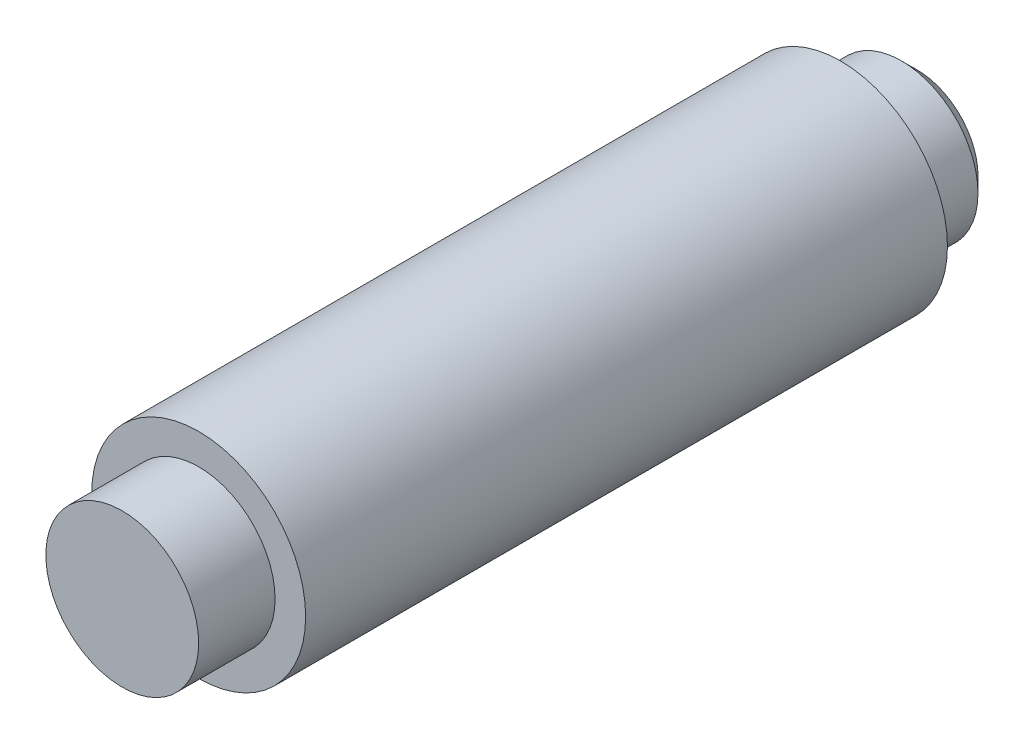
from build123d import *

# Parameters (mm, degrees)
SKETCH3_R           = 3.5
BOSS_EXTRUDE1_DEPTH = 21
SKETCH4_R           = 2.5
BOSS_EXTRUDE2_DEPTH = 2.5
BOSS_EXTRUDE3_START = 2.5
SKETCH5_R           = 2.5
BOSS_EXTRUDE3_DEPTH = 2.5
CHAMFER1_SIZE       = 0.5


with BuildPart() as part:
    # Sketch3 → Boss-Extrude1 (new body)
    with BuildSketch(Plane.XY):
        with Locations(Location((0, 0, 0), (0, 0, 180))):
            Circle(SKETCH3_R)
    extrude(amount=BOSS_EXTRUDE1_DEPTH)

    # Sketch4 → Boss-Extrude2 (add)
    with BuildSketch(Plane.XY):
        Circle(SKETCH4_R)
    extrude(amount=-BOSS_EXTRUDE2_DEPTH)

    # Sketch5 → Boss-Extrude3 (add)
    with BuildSketch(Plane.XY.offset(21).offset(BOSS_EXTRUDE3_START)):
        Circle(SKETCH5_R)
    extrude(amount=-BOSS_EXTRUDE3_DEPTH)

    # Chamfer1
    chamfer1_edges = [part.edges().sort_by_distance(p)[0] for p in [
        (-2.5, 0, -2.5),
    ]]
    chamfer(chamfer1_edges, length=CHAMFER1_SIZE)


solid = part.part
